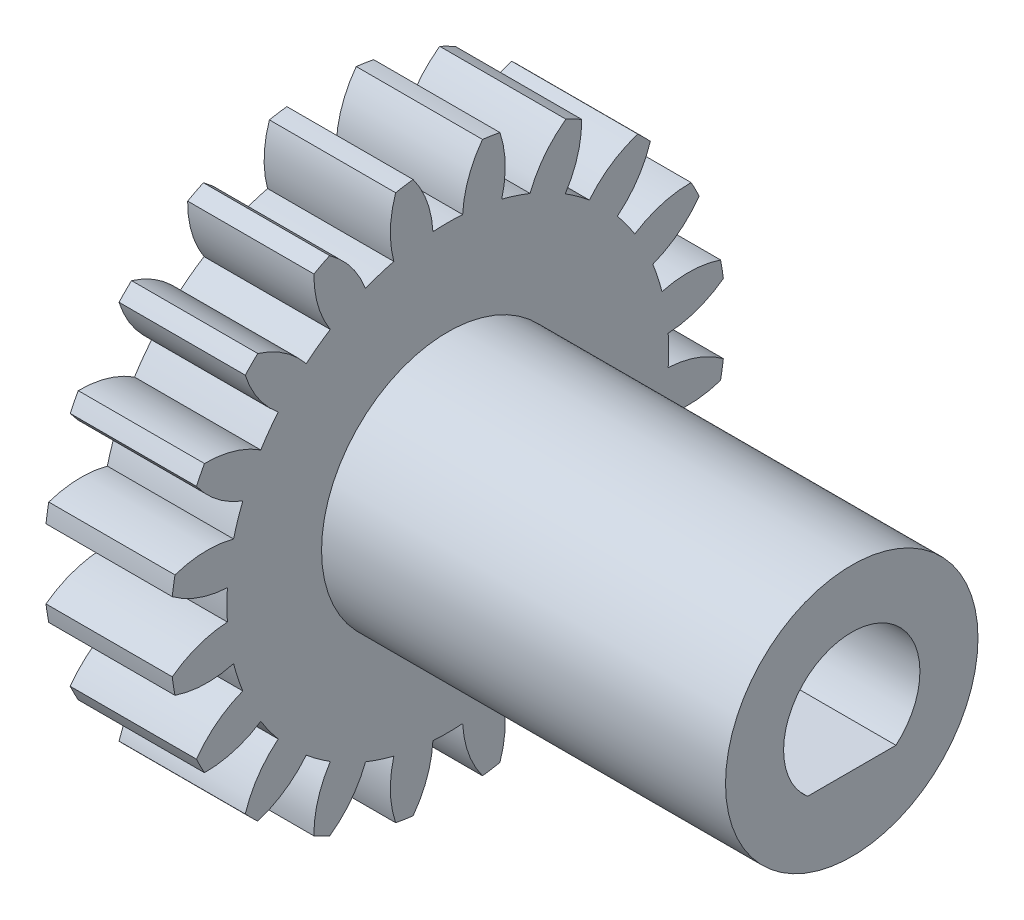
from build123d import *

# Parameters (mm, degrees)
BASPROSKE_W              = 5
BASPROSKE_H              = 11
TOOTHCUT_DEPTH           = 17.340134638
TEETHCUTS_COUNT          = 20
TEETHCUTS_ANGLE          = 342
BORSKE_R                 = 2.5
BORE_DEPTH               = 50.0000508
BOSS_EXTRUDE2_DEPTH      = 16
BOSS_EXTRUDE2_DEPTH_BACK = 5
SKETCH1_R                = 5
CUT_EXTRUDE1_DEPTH       = 27.061912983


with BuildPart() as part:
    # BasProSke → Base-Revolve (revolve)
    with BuildSketch(Plane(origin=(0, 0, 0), x_dir=(1, 0, 0), z_dir=(0, 1, 0)), mode=Mode.PRIVATE) as base_revolve_sk:
        with Locations((2.5, 5.5)):
            Rectangle(BASPROSKE_W, BASPROSKE_H)
    revolve(base_revolve_sk.sketch.rotate(Axis((-10, 0, 0), (1, 0, 0)), 180), axis=Axis((-10, 0, 0), (1, 0, 0)))

    # TooCutSke → ToothCut (cut, through all)
    with BuildSketch(Plane(origin=(0, 0, 0), x_dir=(0, 0, -1), z_dir=(1, 0, 0))):
        with BuildLine():
            ThreePointArc((0.589353609, 8.729127295), (0, 8.749), (-0.589353609, 8.729127295))
            ThreePointArc((-0.589353609, 8.729127295), (-0.82475631, 9.893403384), (-1.391689312, 10.937213814))
            ThreePointArc((-1.391689312, 10.937213814), (0, 11.0254), (1.391689312, 10.937213814))
            ThreePointArc((1.391689312, 10.937213814), (0.82475631, 9.893403384), (0.589353609, 8.729127295))
        make_face()
    toothcut = extrude(amount=TOOTHCUT_DEPTH, mode=Mode.SUBTRACT)

    # TeethCuts: ToothCut ×20 about axis
    teethcuts_axis = Axis((-10, 0, 0), (1, 0, 0))
    for i in range(1, TEETHCUTS_COUNT):
        add(toothcut.rotate(teethcuts_axis, i * TEETHCUTS_ANGLE / (TEETHCUTS_COUNT - 1)), mode=Mode.SUBTRACT)

    # BorSke → Bore (cut, symmetric)
    with BuildSketch(Plane(origin=(0, 0, 0), x_dir=(0, 0, -1), z_dir=(1, 0, 0))):
        with Locations(Location((0, 0, 0), (0, 0, 180))):
            Circle(BORSKE_R)
    extrude(amount=BORE_DEPTH, both=True, mode=Mode.SUBTRACT)

    # Sketch1 → Boss-Extrude2 (add, two sides: drawn at the far end of the back side and taken through both)
    with BuildSketch(Plane(origin=(5, 0, 0), x_dir=(0, 0, -1), z_dir=(1, 0, 0)).offset(-BOSS_EXTRUDE2_DEPTH_BACK)):
        Circle(SKETCH1_R)
    extrude(amount=BOSS_EXTRUDE2_DEPTH + BOSS_EXTRUDE2_DEPTH_BACK)

    # Sketch2 → Cut-Extrude1 (cut, through all)
    with BuildSketch(Plane(origin=(21, 0, 0), x_dir=(0, 0, -1), z_dir=(1, 0, 0))):
        with BuildLine():
            ThreePointArc((2.7, 0), (-1.132475165, 2.451020196), (-1.75, -2.056088519))
            Line((-1.75, -2.056088519), (1.75, -2.056088519))
            ThreePointArc((1.75, -2.056088519), (2.451020196, -1.132475165), (2.7, 0))
        make_face()
    extrude(amount=-CUT_EXTRUDE1_DEPTH, mode=Mode.SUBTRACT)


solid = part.part
